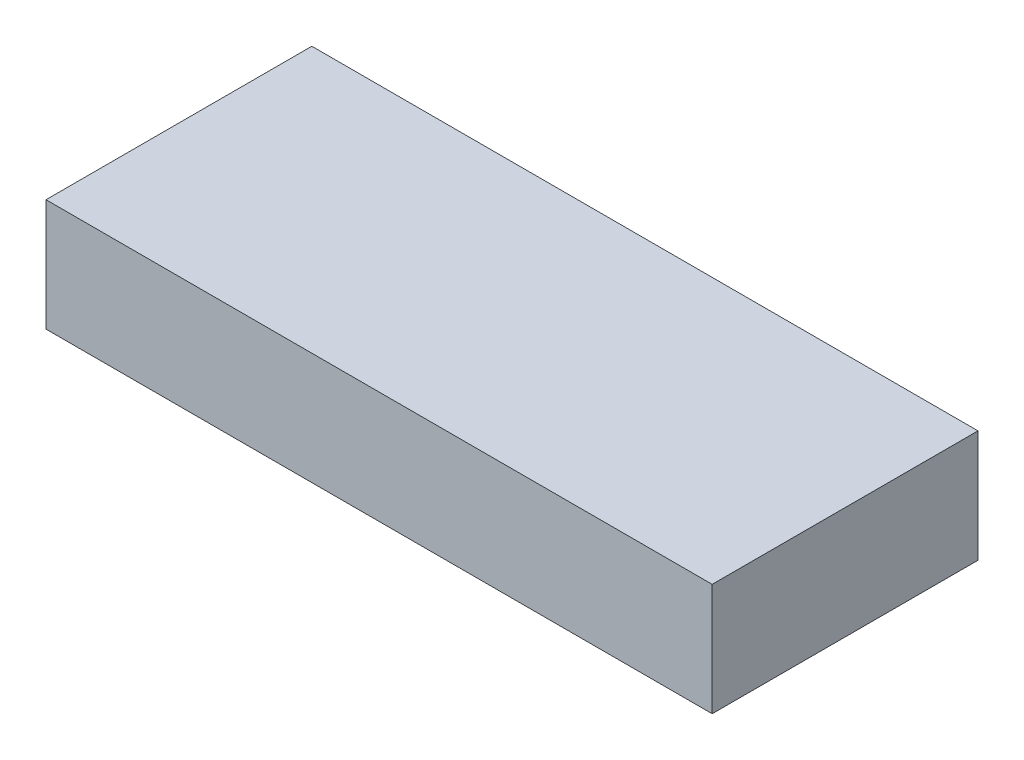
from build123d import *

# Parameters (mm, degrees)
SKETCH1_W           = 41.6
SKETCH1_H           = 16.6
BOSS_EXTRUDE1_DEPTH = 7


with BuildPart() as part:
    # Sketch1 → Boss-Extrude1 (new body)
    with BuildSketch(Plane(origin=(0, 0, 0), x_dir=(1, 0, 0), z_dir=(0, 1, 0))):
        with Locations((20.8, 8.3)):
            Rectangle(SKETCH1_W, SKETCH1_H)
    extrude(amount=BOSS_EXTRUDE1_DEPTH)


solid = part.part
